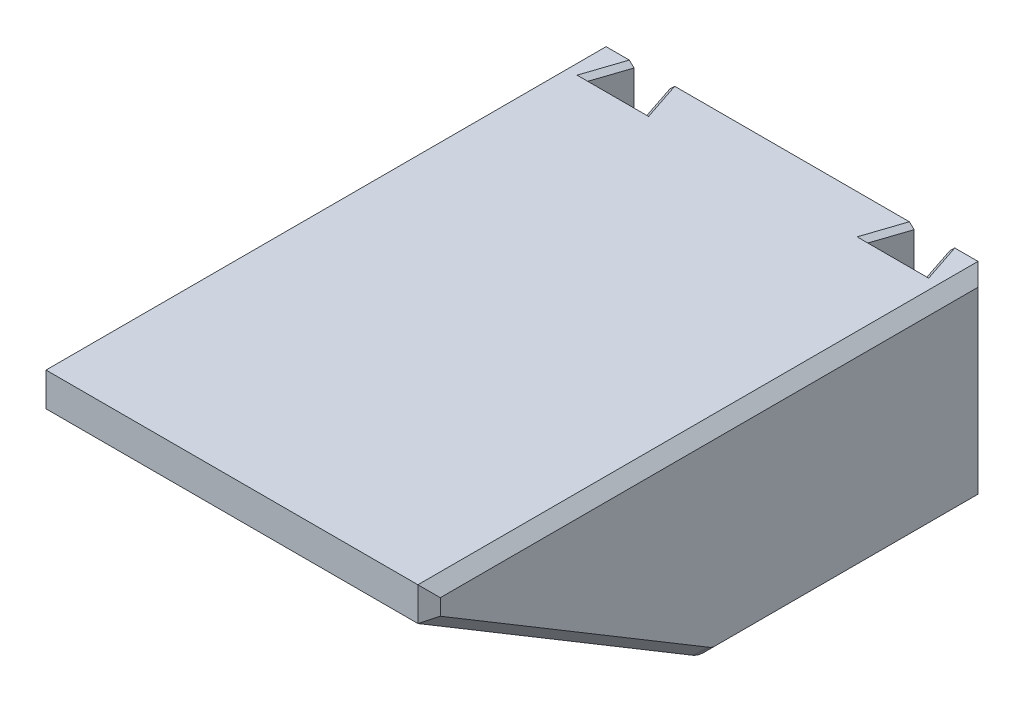
from build123d import *

# Parameters (mm, degrees)
SKETCH_1_W          = 15.2
SKETCH_1_H          = 25
EXTRUDE_1_DEPTH     = 3
EXTRUDE_3_DEPTH     = 10
EXTRUDE_4_DEPTH     = 25
CUT_EXTRUDE_1_DEPTH = 18
FILLET_2_R          = 2
CHAMFER_1_SIZE      = 1
CHAMFER_2_SIZE      = 0.4


with BuildPart() as part:
    # 草图1 → 凸台-拉伸1 (new body)
    with BuildSketch(Plane(origin=(0, 0, 0), x_dir=(1, 0, 0), z_dir=(0, 1, 0))):
        Rectangle(SKETCH_1_W, SKETCH_1_H)
    extrude(amount=EXTRUDE_1_DEPTH)

    # 草图4 → 凸台-拉伸3 (add)
    with BuildSketch(Plane.ZY.offset(7.6)):
        Polygon((-12.5, -15), (-12.5, 3), (12.5, 3), (12.5, 0), align=None)
    extrude_3 = extrude(amount=EXTRUDE_3_DEPTH)

    # 镜向4: 凸台-拉伸3 across plane
    add(extrude_3.mirror(Plane(origin=(0, 0, 0), x_dir=(0, 0, 1), z_dir=(1, 0, 0))))

    # 草图5 → 凸台-拉伸4 (add)
    with BuildSketch(Plane(origin=(0, 0, -12.5), x_dir=(-1, 0, 0), z_dir=(0, 0, -1))):
        Polygon((7.6, 0), (7.6, -15), (17.6, -15), (17.6, 3), (-17.6, 3), (-17.6, -15), (-7.6, -15), (-7.6, 0), align=None)
    extrude(amount=EXTRUDE_4_DEPTH)

    # 草图6 → 切除-拉伸1 (cut)
    with BuildSketch(Plane(origin=(0, 3, 0), x_dir=(1, 0, 0), z_dir=(0, 1, 0))):
        Polygon((14.072075922, 37.6), (10.927924078, 37.6), (9.861257411, 34.4), (15.138742589, 34.4), align=None)
        Polygon((-14.072075922, 37.6), (-15.138742589, 34.4), (-9.861257411, 34.4), (-10.927924078, 37.6), align=None)
    extrude(amount=-CUT_EXTRUDE_1_DEPTH, mode=Mode.SUBTRACT)

    # 圆角2
    fillet_2_edges = [part.edges().sort_by_distance(p)[0] for p in [
        (-12.6, -15, -12.5),
        (12.6, -15, -12.5),
    ]]
    fillet(fillet_2_edges, radius=FILLET_2_R)

    # 倒角1
    chamfer_1_edges = [part.edges().sort_by_distance(p)[0] for p in [
        (-7.6, -7.357492926, 0.23751179),
        (-17.6, -7.357492926, 0.23751179),
        (-7.6, -14.927429856, -12.520100766),
        (-17.6, -14.927429856, -12.520100766),
        (7.6, -7.357492926, 0.23751179),
        (7.6, -14.927429856, -12.520100766),
        (17.6, -7.357492926, 0.23751179),
        (17.6, -14.927429856, -12.520100766),
        (-17.6, 1.5, 12.5),
        (-17.6, 3, -12.5),
        (17.6, 3, -12.5),
        (17.6, 1.5, 12.5),
        (7.6, -15, -25.276983965),
        (-7.6, -15, -25.276983965),
        (-17.6, -15, -25.276983965),
        (17.6, -15, -25.276983965),
        (7.6, -7.5, -37.5),
        (-7.6, -7.5, -37.5),
        (-17.6, -6, -37.5),
        (17.6, -6, -37.5),
    ]]
    chamfer(chamfer_1_edges, length=CHAMFER_1_SIZE)

    # 倒角2
    chamfer_2_edges = [part.edges().sort_by_distance(p)[0] for p in [
        (10.377924078, 3, -35.95),
        (12.5, 3, -34.4),
        (14.622075922, 3, -35.95),
        (14.622075922, -15, -35.95),
        (12.5, -15, -34.4),
        (10.377924078, -15, -35.95),
        (-14.622075922, 3, -35.95),
        (-12.5, 3, -34.4),
        (-10.377924078, 3, -35.95),
        (-10.377924078, -15, -35.95),
        (-12.5, -15, -34.4),
        (-14.622075922, -15, -35.95),
    ]]
    chamfer(chamfer_2_edges, length=CHAMFER_2_SIZE)


solid = part.part
